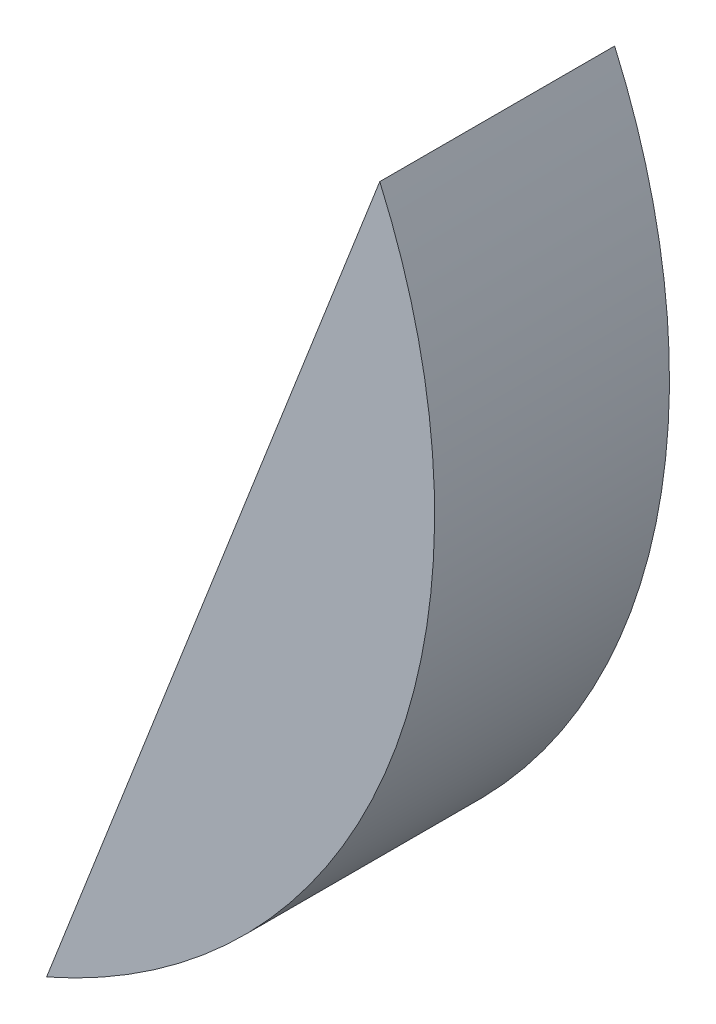
from build123d import *

# Parameters (mm, degrees)
CURVEBOSS_DEPTH = 7.139


with BuildPart() as part:
    # CurveSketch → CurveBoss (new body)
    with BuildSketch(Plane.XY):
        with BuildLine():
            Line((2.799822369, -4.345307673), (12.927307673, 21.655822369))
            ThreePointArc((12.927307673, 21.655822369), (13.248575371, 6.557786465), (2.799822369, -4.345307673))
        make_face()
    extrude(amount=CURVEBOSS_DEPTH)


solid = part.part
